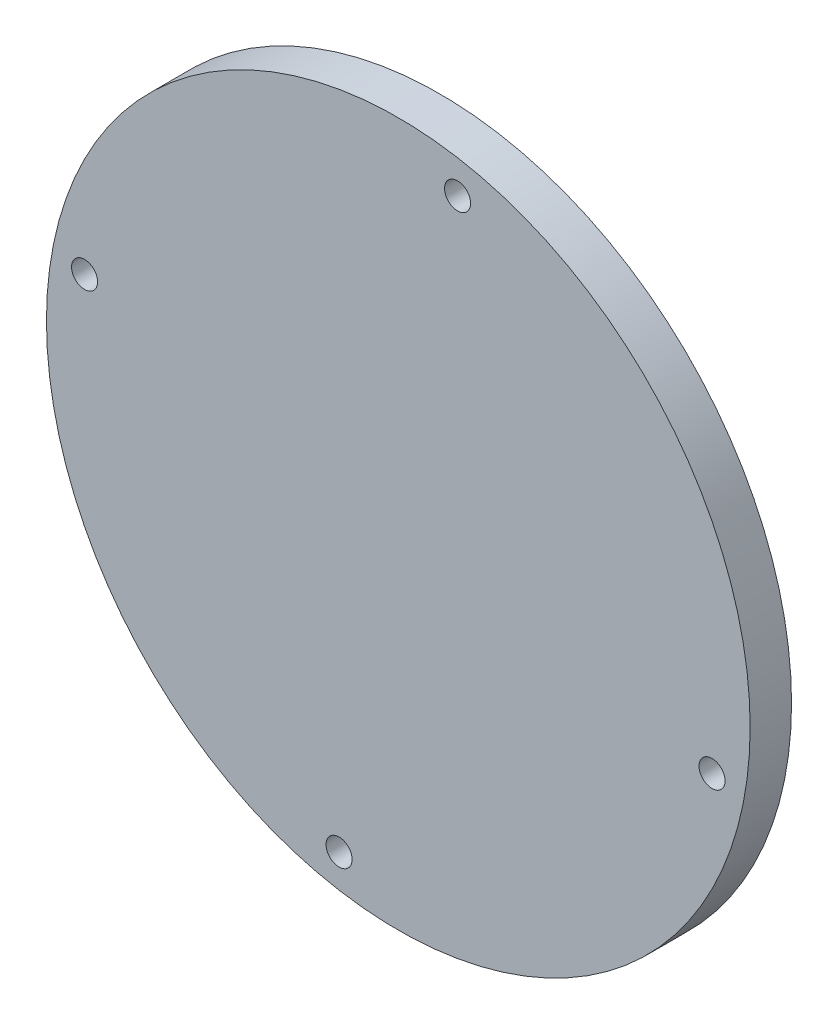
from build123d import *

# Parameters (mm, degrees)
SKETCH1_R             = 27
BOSS_EXTRUDE1_DEPTH   = 3.175
F_1_5MM_DOWEL_HOLE1_D = 2


with BuildPart() as part:
    # Sketch1 → Boss-Extrude1 (new body)
    with BuildSketch(Plane.XY):
        Circle(SKETCH1_R)
    extrude(amount=BOSS_EXTRUDE1_DEPTH)

    # Ø1.5mm Dowel Hole1 (through all)
    with Locations(Plane(origin=(0, 0, 0), x_dir=(-1, 0, 0), z_dir=(0, 0, -1))):
        with Locations((-24.074719774, -4.545092718), (4.545092718, -24.074719774), (24.074719774, 4.545092718), (-4.545092718, 24.074719774)):
            Hole(F_1_5MM_DOWEL_HOLE1_D / 2)


solid = part.part
